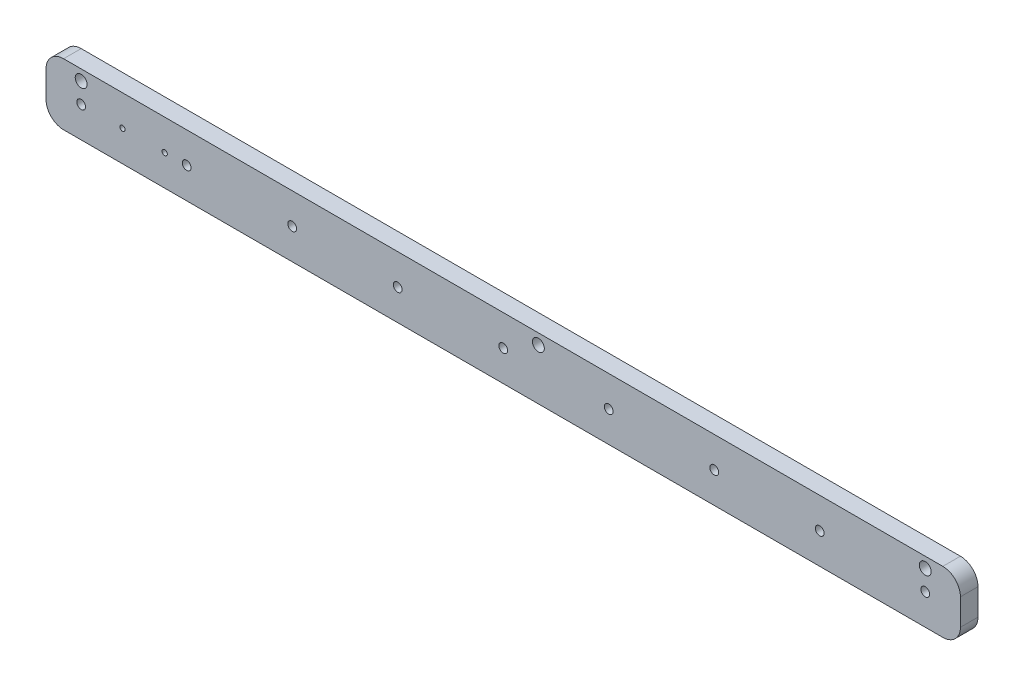
from build123d import *

# Parameters (mm, degrees)
ESQUISSE1_R             = 7
BOSS_EXTRU_1_DEPTH      = 10
BOSS_EXTRU_2_START      = -4
ESQUISSE2_R             = 7
ESQUISSE2_R_2           = 2.5
BOSS_EXTRU_2_DEPTH      = 4
ESQUISSE3_R             = 3.375
ENL_V_MAT_EXTRU_1_DEPTH = 261.780079761
ESQUISSE4_R             = 3.375
ENL_V_MAT_EXTRU_2_DEPTH = 261.780079761
ESQUISSE5_R             = 1.5
ENL_V_MAT_EXTRU_3_DEPTH = 261.780079761


with BuildPart() as part:
    # Esquisse1 → Boss.-Extru.1 (new body)
    with BuildSketch(Plane.XY):
        with BuildLine():
            Line((-250, 17.5), (250, 17.5))
            ThreePointArc((250, 17.5), (257.071067812, 14.571067812), (260, 7.5))
            Line((260, 7.5), (260, -7.5))
            ThreePointArc((260, -7.5), (257.071067812, -14.571067812), (250, -17.5))
            Line((250, -17.5), (-250, -17.5))
            ThreePointArc((-250, -17.5), (-257.071067812, -14.571067812), (-260, -7.5))
            Line((-260, -7.5), (-260, 7.5))
            ThreePointArc((-260, 7.5), (-257.071067812, 14.571067812), (-250, 17.5))
        make_face()
        with Locations((-240, 0)):
            Circle(ESQUISSE1_R, mode=Mode.SUBTRACT)
        with Locations((-180, 0)):
            Circle(ESQUISSE1_R, mode=Mode.SUBTRACT)
        with Locations((-120, 0)):
            Circle(ESQUISSE1_R, mode=Mode.SUBTRACT)
        with Locations((-60, 0)):
            Circle(ESQUISSE1_R, mode=Mode.SUBTRACT)
        Circle(ESQUISSE1_R, mode=Mode.SUBTRACT)
        with Locations((60, 0)):
            Circle(ESQUISSE1_R, mode=Mode.SUBTRACT)
        with Locations((120, 0)):
            Circle(ESQUISSE1_R, mode=Mode.SUBTRACT)
        with Locations((180, 0)):
            Circle(ESQUISSE1_R, mode=Mode.SUBTRACT)
        with Locations((240, 0)):
            Circle(ESQUISSE1_R, mode=Mode.SUBTRACT)
    extrude(amount=BOSS_EXTRU_1_DEPTH)

    # Esquisse2 → Boss.-Extru.2 (add)
    # profile 1 of 9: a face of its own
    with BuildSketch(Plane.XY.offset(10).offset(BOSS_EXTRU_2_START)):
        with Locations((-240, 0)):
            Circle(ESQUISSE2_R)
        with Locations((-240, 0)):
            Circle(ESQUISSE2_R_2, mode=Mode.SUBTRACT)
    # profile 2 of 9: a face of its own
    with BuildSketch(Plane.XY.offset(10).offset(BOSS_EXTRU_2_START)):
        with Locations((-180, 0)):
            Circle(ESQUISSE2_R)
        with Locations((-180, 0)):
            Circle(ESQUISSE2_R_2, mode=Mode.SUBTRACT)
    # profile 3 of 9: a face of its own
    with BuildSketch(Plane.XY.offset(10).offset(BOSS_EXTRU_2_START)):
        with Locations((-120, 0)):
            Circle(ESQUISSE2_R)
        with Locations((-120, 0)):
            Circle(ESQUISSE2_R_2, mode=Mode.SUBTRACT)
    # profile 4 of 9: a face of its own
    with BuildSketch(Plane.XY.offset(10).offset(BOSS_EXTRU_2_START)):
        with Locations((-60, 0)):
            Circle(ESQUISSE2_R)
        with Locations((-60, 0)):
            Circle(ESQUISSE2_R_2, mode=Mode.SUBTRACT)
    # profile 5 of 9: a face of its own
    with BuildSketch(Plane.XY.offset(10).offset(BOSS_EXTRU_2_START)):
        Circle(ESQUISSE2_R)
        Circle(ESQUISSE2_R_2, mode=Mode.SUBTRACT)
    # profile 6 of 9: a face of its own
    with BuildSketch(Plane.XY.offset(10).offset(BOSS_EXTRU_2_START)):
        with Locations((60, 0)):
            Circle(ESQUISSE2_R)
        with Locations((60, 0)):
            Circle(ESQUISSE2_R_2, mode=Mode.SUBTRACT)
    # profile 7 of 9: a face of its own
    with BuildSketch(Plane.XY.offset(10).offset(BOSS_EXTRU_2_START)):
        with Locations((120, 0)):
            Circle(ESQUISSE2_R)
        with Locations((120, 0)):
            Circle(ESQUISSE2_R_2, mode=Mode.SUBTRACT)
    # profile 8 of 9: a face of its own
    with BuildSketch(Plane.XY.offset(10).offset(BOSS_EXTRU_2_START)):
        with Locations((180, 0)):
            Circle(ESQUISSE2_R)
        with Locations((180, 0)):
            Circle(ESQUISSE2_R_2, mode=Mode.SUBTRACT)
    # profile 9 of 9: a face of its own
    with BuildSketch(Plane.XY.offset(10).offset(BOSS_EXTRU_2_START)):
        with Locations((240, 0)):
            Circle(ESQUISSE2_R)
        with Locations((240, 0)):
            Circle(ESQUISSE2_R_2, mode=Mode.SUBTRACT)
    extrude(amount=BOSS_EXTRU_2_DEPTH)

    # Esquisse3 → Enlèv. mat.-Extru.1 (cut, through all)
    with BuildSketch(Plane.XY.offset(10)):
        with Locations((20.000000156, 11.500000313)):
            Circle(ESQUISSE3_R)
        with Locations((-239.999999844, 11.500000313)):
            Circle(ESQUISSE3_R)
    extrude(amount=-ENL_V_MAT_EXTRU_1_DEPTH, mode=Mode.SUBTRACT)

    # Esquisse4 → Enlèv. mat.-Extru.2 (cut, through all)
    with BuildSketch(Plane.XY.offset(10)):
        with Locations((240.000000156, 11.500000313)):
            Circle(ESQUISSE4_R)
    extrude(amount=-ENL_V_MAT_EXTRU_2_DEPTH, mode=Mode.SUBTRACT)

    # Esquisse5 → Enlèv. mat.-Extru.3 (cut, through all)
    with BuildSketch(Plane.XY.offset(10)):
        with Locations((-192.499999844, 0)):
            Circle(ESQUISSE5_R)
        with Locations((-216.499999844, 0)):
            Circle(ESQUISSE5_R)
    extrude(amount=-ENL_V_MAT_EXTRU_3_DEPTH, mode=Mode.SUBTRACT)


solid = part.part
